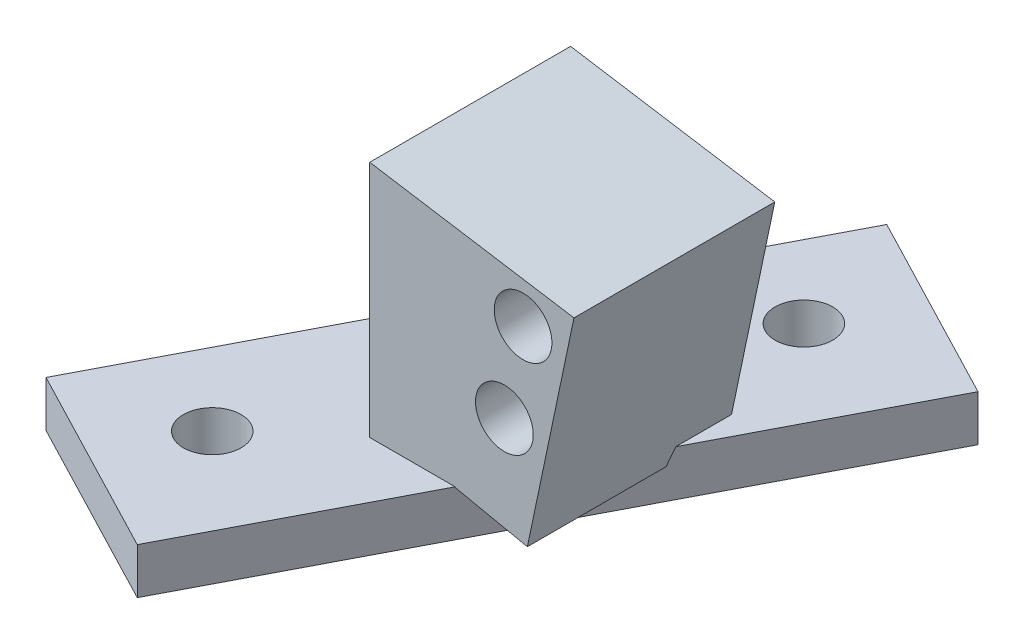
from build123d import *

# Parameters (mm, degrees)
SKETCH2_R           = 3.175
BOSS_EXTRUDE1_DEPTH = 22.098
SKETCH3_W           = 8.89
SKETCH3_H           = 22.098
BOSS_EXTRUDE2_DEPTH = 7.62
SKETCH4_R           = 3.175
BOSS_EXTRUDE3_DEPTH = 5.0531014
BOSS_EXTRUDE4_DEPTH = 22.098
CUT_EXTRUDE1_DEPTH  = 126.746
BOSS_EXTRUDE6_REACH = 111.16
SKETCH8_W           = 22.098
SKETCH8_H           = 5.750865106


with BuildPart() as part:
    # Sketch2 → Boss-Extrude1 (new body)
    # profile 1 of 2: a face of its own
    with BuildSketch(Plane.XY):
        with BuildLine():
            Line((-633.396746705, 209.866473294), (-629.456250373, 228.608305414))
            Line((-629.456250373, 228.608305414), (-640.203126947, 230.867851197))
            ThreePointArc((-640.203126947, 230.867851197), (-642.751451447, 226.300988286), (-641.845462116, 221.150320569))
            ThreePointArc((-641.845462116, 221.150320569), (-644.490547106, 217.002439965), (-644.037989982, 212.103809529))
            Line((-644.037989982, 212.103809529), (-633.396746705, 209.866473294))
        make_face()
        with Locations(Location((-637.11116423, 215.213960129, 0), (0, 0, 180))):
            Circle(SKETCH2_R, mode=Mode.SUBTRACT)
        with Locations(Location((-635.053635704, 225, 0), (0, 0, 180))):
            Circle(SKETCH2_R, mode=Mode.SUBTRACT)
    # profile 2 of 2: a face of its own
    with BuildSketch(Plane.XY):
        with BuildLine():
            ThreePointArc((-641.845462116, 221.150320569), (-642.751451447, 226.300988286), (-640.203126947, 230.867851197))
            Line((-640.203126947, 230.867851197), (-646.417262265, 232.174381811))
            Line((-646.417262265, 232.174381811), (-650.357758597, 213.432549691))
            Line((-650.357758597, 213.432549691), (-644.037989982, 212.103809529))
            ThreePointArc((-644.037989982, 212.103809529), (-644.490547106, 217.002439965), (-641.845462116, 221.150320569))
        make_face()
    extrude(amount=BOSS_EXTRUDE1_DEPTH)

    # Sketch3 → Boss-Extrude2 (add)
    with BuildSketch(Plane(origin=(15.442364745, 73.44714554, 0), x_dir=(0.9786039871389689, -0.20575285260650172, 0), z_dir=(-0.20575285260650172, -0.9786039871389689, 0))):
        with Locations((-675.912051568, 11.049)):
            Rectangle(SKETCH3_W, SKETCH3_H)
    extrude(amount=BOSS_EXTRUDE2_DEPTH)

    # Sketch4 → Boss-Extrude3 (add)
    with BuildSketch(Plane(origin=(0, 205.975587309, 0), x_dir=(1, 0, 0), z_dir=(0, 1, 0))):
        Polygon((-643.78094836, 26.639989184), (-675.455245779, -34.187268547), (-654.503634783, -45.097304324), (-622.829337364, 15.729953406), align=None)
        with Locations(Location((-638.898775927, 12.642774556, 0), (0, 0, 270))):
            Circle(SKETCH4_R, mode=Mode.SUBTRACT)
        with Locations(Location((-661.188096333, -30.161591995, 0), (0, 0, 270))):
            Circle(SKETCH4_R, mode=Mode.SUBTRACT)
    extrude(amount=-BOSS_EXTRUDE3_DEPTH)

    # Sketch5 → Boss-Extrude4 (add)
    with BuildSketch(Plane.XY.offset(22.098)):
        Polygon((-651.925595334, 205.975587309), (-651.925595334, 232.199360665), (-646.417262265, 232.174381811), align=None)
    extrude(amount=-BOSS_EXTRUDE4_DEPTH)

    # Sketch6 → Cut-Extrude1 (cut)
    with BuildSketch(Plane(origin=(0, 0, 0), x_dir=(-1, 0, 0), z_dir=(0, 0, -1))):
        Polygon((629.456250373, 228.608305414), (651.925595334, 232.199360665), (646.417262265, 232.174381811), align=None)
    extrude(amount=-CUT_EXTRUDE1_DEPTH, mode=Mode.SUBTRACT)

    # Boss-Extrude6: up to this face of the body (flat: up to its plane)
    boss_extrude6_end = Plane(part.part.faces().sort_by_distance((-642.249597602, 208.78949707, 11.049))[0])
    # Sketch8 → Boss-Extrude6 (add, up to the picked face)
    with BuildSketch(Plane(origin=(-648.83911145, 136.419327755, 0), x_dir=(0, 0, -1), z_dir=(0.9786039871389688, -0.20575285260650203, 0)), mode=Mode.PRIVATE) as boss_extrude6_sk1:
        with Locations((-11.049, 72.177547513)):
            Rectangle(SKETCH8_W, SKETCH8_H)
    boss_extrude6_tool1 = split(extrude(boss_extrude6_sk1.sketch, amount=-BOSS_EXTRUDE6_REACH, mode=Mode.PRIVATE), bisect_by=boss_extrude6_end, keep=Keep.BOTH, mode=Mode.PRIVATE)
    add(boss_extrude6_tool1.solids().sort_by(Axis((-633.988375, 207.052564, 11.049), (-0.9786039871389688, 0.20575285260650203, 0)))[0])


solid = part.part
